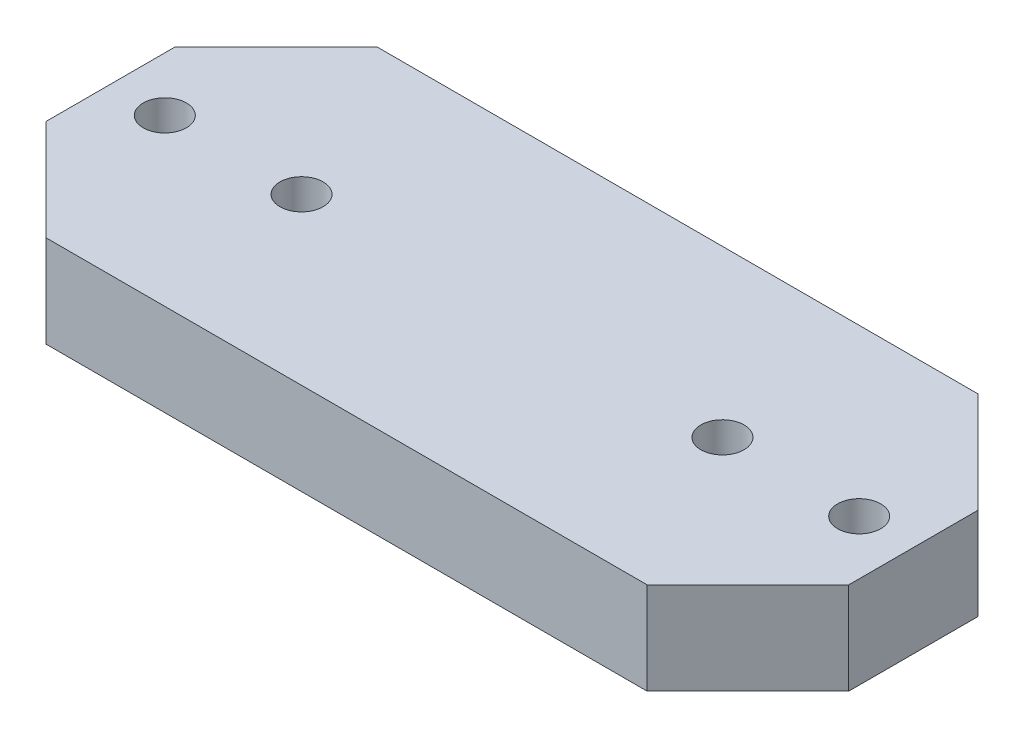
from build123d import *

# Parameters (mm, degrees)
SKETCH1_R           = 1.5
BOSS_EXTRUDE1_DEPTH = 6.4


with BuildPart() as part:
    # Sketch1 → Boss-Extrude1 (new body)
    with BuildSketch(Plane(origin=(0, 0, 0), x_dir=(1, 0, 0), z_dir=(0, 1, 0))):
        Polygon((109.959478532, 18.658489835), (116.959478532, 11.658489835), (116.959478532, 2.671691354), (109.959478532, -4.328308646), (68.182724108, -4.328308646), (61.182724108, 2.671691354), (61.182724108, 11.658489835), (68.182724108, 18.658489835), align=None)
        with Locations(Location((74.44610132, 7.165090594, 0), (0, 0, 270))):
            Circle(SKETCH1_R, mode=Mode.SUBTRACT)
        with Locations(Location((113.19610132, 7.165090594, 0), (0, 0, 90))):
            Circle(SKETCH1_R, mode=Mode.SUBTRACT)
        with Locations(Location((103.69610132, 7.165090594, 0), (0, 0, 90))):
            Circle(SKETCH1_R, mode=Mode.SUBTRACT)
        with Locations(Location((64.94610132, 7.165090594, 0), (0, 0, 270))):
            Circle(SKETCH1_R, mode=Mode.SUBTRACT)
    extrude(amount=BOSS_EXTRUDE1_DEPTH)


solid = part.part
